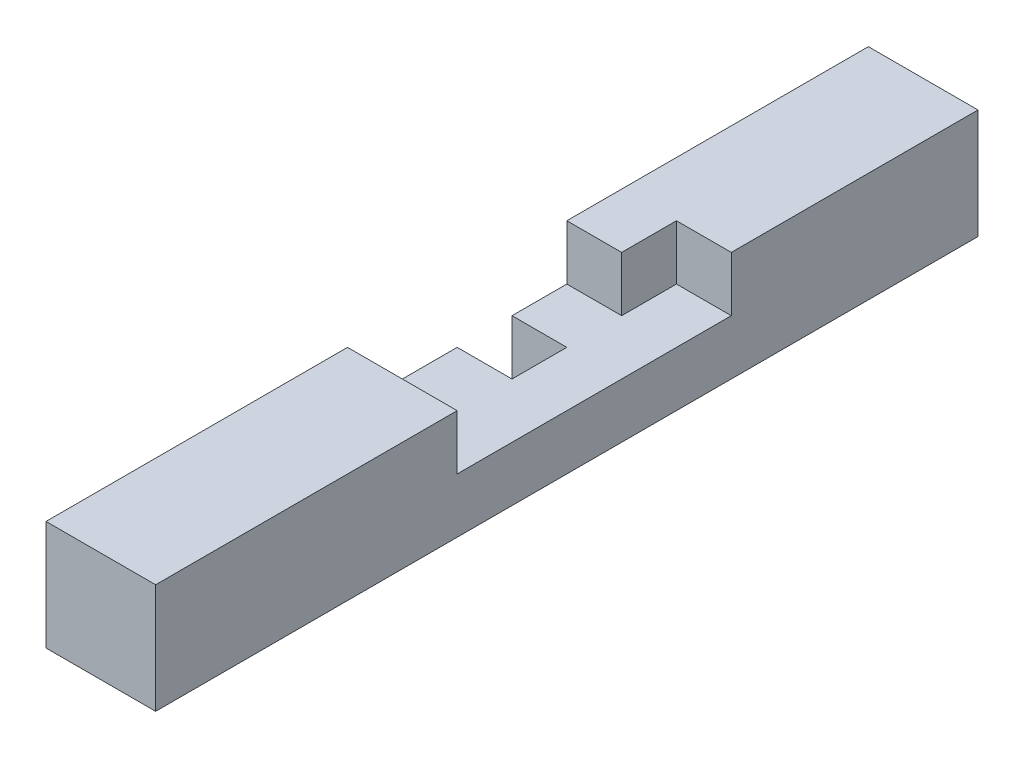
from build123d import *

# Parameters (mm, degrees)
SKETCH_1_W          = 4
SKETCH_1_H          = 4
EXTRUDE_1_DEPTH     = 30
SKETCH_4_W          = 10
SKETCH_4_H          = 2
CUT_EXTRUDE_1_DEPTH = 4
SKETCH_6_W          = 4
SKETCH_6_H          = 2
CUT_EXTRUDE_2_DEPTH = 2
SKETCH_8_W          = 2
SKETCH_8_H          = 2
EXTRUDE_4_DEPTH     = 2
SKETCH_10_W         = 2
SKETCH_10_H         = 2
EXTRUDE_6_DEPTH     = 2


with BuildPart() as part:
    # 草圖1 → 填料-伸長1 (new body)
    with BuildSketch(Plane.XY):
        Rectangle(SKETCH_1_W, SKETCH_1_H)
    extrude(amount=EXTRUDE_1_DEPTH)

    # 草圖4 → 除料-伸長1 (cut)
    with BuildSketch(Plane.ZY.offset(2)):
        with Locations((14, 1)):
            Rectangle(SKETCH_4_W, SKETCH_4_H)
    extrude(amount=-CUT_EXTRUDE_1_DEPTH, mode=Mode.SUBTRACT)

    # 草圖6 → 除料-伸長2 (cut)
    with BuildSketch(Plane.ZY.offset(2)):
        with Locations((13, -1)):
            Rectangle(SKETCH_6_W, SKETCH_6_H)
    extrude(amount=-CUT_EXTRUDE_2_DEPTH, mode=Mode.SUBTRACT)

    # 草圖8 → 填料-伸長4 (add)
    with BuildSketch(Plane.ZY.offset(2)):
        with Locations((10, 1)):
            Rectangle(SKETCH_8_W, SKETCH_8_H)
    extrude(amount=-EXTRUDE_4_DEPTH)

    # 草圖10 → 填料-伸長6 (add)
    with BuildSketch(Plane.XY.offset(11)):
        with Locations((-1, -1)):
            Rectangle(SKETCH_10_W, SKETCH_10_H)
    extrude(amount=EXTRUDE_6_DEPTH)


solid = part.part
